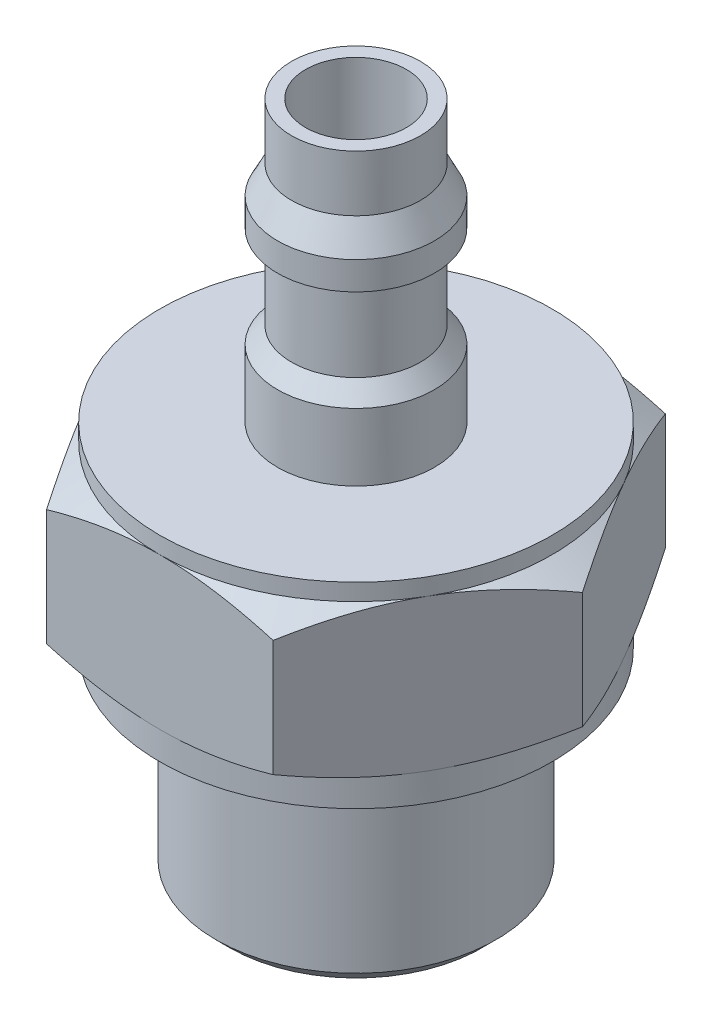
from build123d import *

# Parameters (mm, degrees)
THREADS_SKETCH_W  = 2.5
THREADS_SKETCH_H  = 4
THREADS_CHAM_SIZE = 0.25
NUT_DEPTH         = 2.7
GASKET_SKETCH_R   = 3.5
GASKET_DEPTH      = 0.5
STEM_SKETCH_R     = 1.15
STEM_DEPTH        = 5.3
TOP_START         = 0.3
TOP_FLAT_SKETCH_R = 3.5
TOP_FLAT_DEPTH    = 0.3
PORT_SKETCH_R     = 0.9
PORT_DEPTH        = 14.137097599


with BuildPart() as part:
    # Threads_Sketch → Threads (revolve)
    with BuildSketch(Plane.XY, mode=Mode.PRIVATE) as threads_sk:
        with Locations((-1.25, 2)):
            Rectangle(THREADS_SKETCH_W, THREADS_SKETCH_H)
    revolve(threads_sk.sketch.rotate(Axis((0, 0, 0), (0, 1, 0)), 270), axis=Axis((0, 0, 0), (0, 1, 0)))

    # Threads Cham
    threads_cham_edges = [part.edges().sort_by_distance(p)[0] for p in [
        (0, 0, 2.5),
    ]]
    chamfer(threads_cham_edges, length=THREADS_CHAM_SIZE)

    # Nut_Sketch → Nut (add)
    with BuildSketch(Plane(origin=(0, 4, 0), x_dir=(-1, 0, 0), z_dir=(0, 1, 0))):
        Polygon((-4.041451884, 0), (-2.020725942, -3.5), (2.020725942, -3.5), (4.041451884, 0), (2.020725942, 3.5), (-2.020725942, 3.5), align=None)
    extrude(amount=NUT_DEPTH)

    # Nut Cham_Sketch → Nut Cham (revolve, cut)
    with BuildSketch(Plane.XY, mode=Mode.PRIVATE) as nut_cham_sk:
        Polygon((-4.041451884, 4.312607391), (-4.041451884, 4), (-3.5, 4), align=None)
        Polygon((-3.5, 6.7), (-4.041451884, 6.387392609), (-4.041451884, 6.7), align=None)
    revolve(nut_cham_sk.sketch.rotate(Axis((0, 0, 0), (0, 1, 0)), 90), axis=Axis((0, 0, 0), (0, 1, 0)), mode=Mode.SUBTRACT)

    # Gasket_Sketch → Gasket (add)
    with BuildSketch(Plane.XZ.offset(-4)):
        with Locations(Location((0, 0, 0), (0, 0, 270))):
            Circle(GASKET_SKETCH_R)
    extrude(amount=GASKET_DEPTH)

    # Stem_Sketch → Stem (add)
    with BuildSketch(Plane(origin=(0, 6.7, 0), x_dir=(-1, 0, 0), z_dir=(0, 1, 0))):
        with Locations(Location((0, 0, 0), (0, 0, 90))):
            Circle(STEM_SKETCH_R)
    extrude(amount=STEM_DEPTH)

    # Top Flat_Sketch → Top Flat (add)
    with BuildSketch(Plane(origin=(0, 6.7, 0), x_dir=(-1, 0, 0), z_dir=(0, 1, 0)).offset(TOP_START)):
        with Locations(Location((0, 0, 0), (0, 0, 270))):
            Circle(TOP_FLAT_SKETCH_R)
    extrude(amount=-TOP_FLAT_DEPTH)

    # Outside Barb_Sketch → Outside Barb (revolve)
    with BuildSketch(Plane.XY, mode=Mode.PRIVATE) as outside_barb_sk:
        Polygon((0, 11), (-1.15, 11), (-1.4, 10.5), (-1.4, 10), (0, 10), align=None)
    revolve(outside_barb_sk.sketch.rotate(Axis((0, 0, 0), (0, 1, 0)), 90), axis=Axis((0, 0, 0), (0, 1, 0)))

    # Inside Barb 2_Sketch → Inside Barb 2 (revolve)
    with BuildSketch(Plane.XY, mode=Mode.PRIVATE) as inside_barb_2_sk:
        Polygon((0, 8.5), (-1.15, 8.5), (-1.4, 8.2), (-1.4, 6.7), (0, 6.7), align=None)
    revolve(inside_barb_2_sk.sketch.rotate(Axis((0, 0, 0), (0, 1, 0)), 270), axis=Axis((0, 0, 0), (0, 1, 0)))

    # Port_Sketch → Port (cut, through all)
    with BuildSketch(Plane(origin=(0, 0, 0), x_dir=(1, 0, 0), z_dir=(0, 1, 0))):
        with Locations(Location((0, 0, 0), (0, 0, 270))):
            Circle(PORT_SKETCH_R)
    extrude(amount=PORT_DEPTH, mode=Mode.SUBTRACT)


solid = part.part
